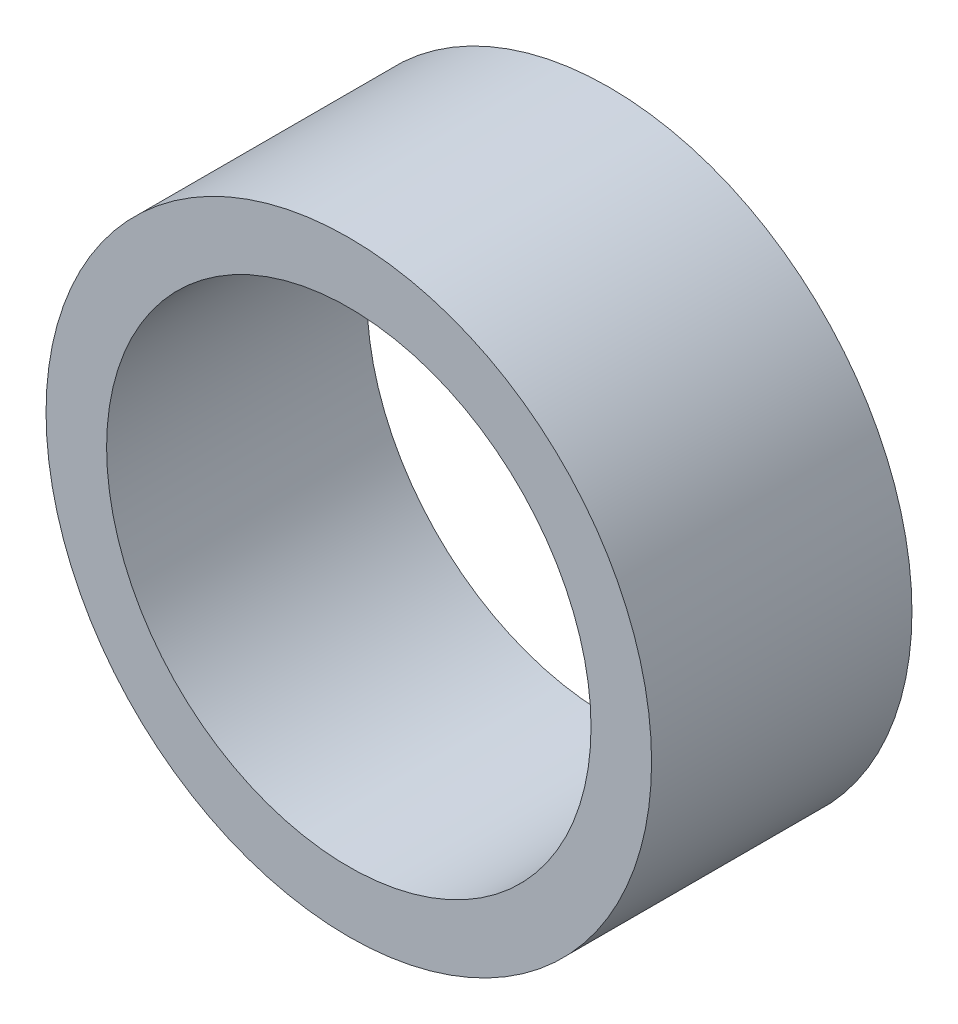
from build123d import *

# Parameters (mm, degrees)
ESQUISSE1_R        = 12.5
ESQUISSE1_R_2      = 10
BOSS_EXTRU_1_DEPTH = 10.75


with BuildPart() as part:
    # Esquisse1 → Boss.-Extru.1 (new body)
    with BuildSketch(Plane.XY):
        Circle(ESQUISSE1_R)
        Circle(ESQUISSE1_R_2, mode=Mode.SUBTRACT)
    extrude(amount=BOSS_EXTRU_1_DEPTH)


solid = part.part
